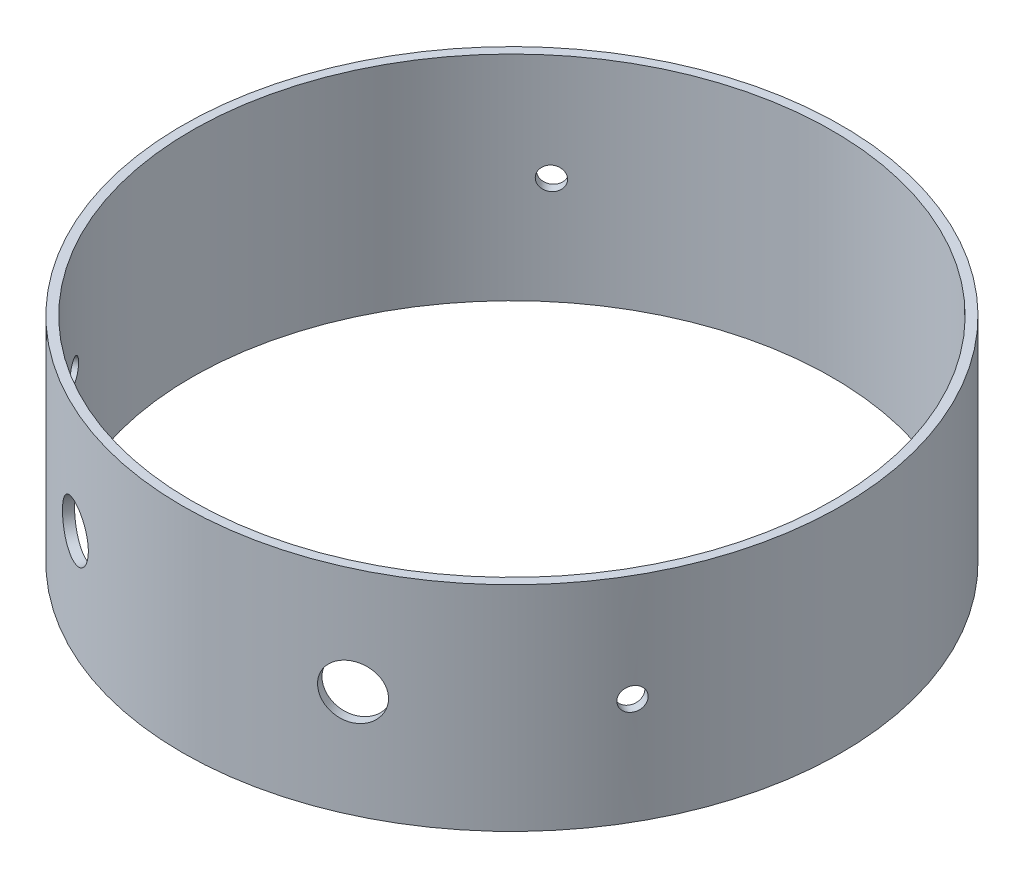
from build123d import *

# Parameters (mm, degrees)
SKETCH1_R           = 78.359
SKETCH1_R_2         = 76.2
BOSS_EXTRUDE1_DEPTH = 50.8
SKETCH4_R           = 6.35
CUT_EXTRUDE1_DEPTH  = 25.4
SKETCH5_R           = 6.35
CUT_EXTRUDE2_DEPTH  = 25.4
SKETCH6_R           = 2.7305
CUT_EXTRUDE3_DEPTH  = 2.54
CIRPATTERN1_COUNT   = 4
CIRPATTERN1_ANGLE   = 240


with BuildPart() as part:
    # Sketch1 → Boss-Extrude1 (new body)
    with BuildSketch(Plane(origin=(0, 0, 0), x_dir=(1, 0, 0), z_dir=(0, 1, 0))):
        with Locations(Location((0, 0, 0), (0, 0, 270))):
            Circle(SKETCH1_R)
        with Locations(Location((0, 0, 0), (0, 0, 270))):
            Circle(SKETCH1_R_2, mode=Mode.SUBTRACT)
    extrude(amount=BOSS_EXTRUDE1_DEPTH)

    # Sketch4 → Cut-Extrude1 (cut)
    with BuildSketch(Plane(origin=(33.115944372, 0, 71.017371884), x_dir=(0, -1, 0), z_dir=(0.4226182617407003, 0, 0.9063077870366496))):
        with Locations(Location((-25.4, 0, 0), (0, 0, 90))):
            Circle(SKETCH4_R)
    extrude(amount=-CUT_EXTRUDE1_DEPTH, mode=Mode.SUBTRACT)

    # Sketch5 → Cut-Extrude2 (cut)
    with BuildSketch(Plane(origin=(-33.115944372, 0, 71.017371884), x_dir=(0, -1, 0), z_dir=(-0.4226182617407003, 0, 0.9063077870366496))):
        with Locations(Location((-25.4, 0, 0), (0, 0, 90))):
            Circle(SKETCH5_R)
    extrude(amount=-CUT_EXTRUDE2_DEPTH, mode=Mode.SUBTRACT)

    # Sketch6 → Cut-Extrude3 (cut)
    with BuildSketch(Plane(origin=(67.860884615, 0, 39.1795), x_dir=(0, -1, 0), z_dir=(0.8660254037844416, 0, 0.49999999999999495))):
        with Locations(Location((-25.4, 0, 0), (0, 0, 90))):
            Circle(SKETCH6_R)
    cut_extrude3 = extrude(amount=-CUT_EXTRUDE3_DEPTH, mode=Mode.SUBTRACT)

    # CirPattern1: Cut-Extrude3 ×4 about axis
    cirpattern1_axis = Axis((0, 50.8, 0), (0, 1, 0))
    for i in range(1, CIRPATTERN1_COUNT):
        add(cut_extrude3.rotate(cirpattern1_axis, i * CIRPATTERN1_ANGLE / (CIRPATTERN1_COUNT - 1)), mode=Mode.SUBTRACT)


solid = part.part
